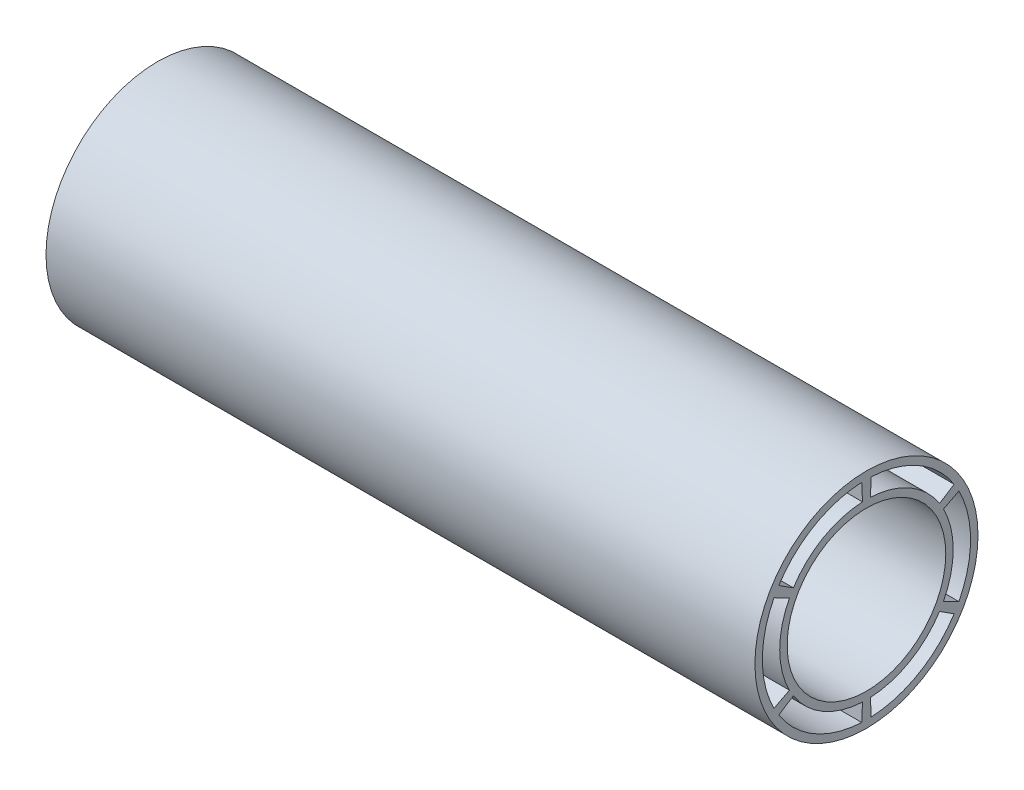
from build123d import *

# Parameters (mm, degrees)
SKETCH1_R           = 22.5
SKETCH1_R_2         = 16
BOSS_EXTRUDE1_DEPTH = 143


with BuildPart() as part:
    # Sketch1 → Boss-Extrude1 (new body)
    with BuildSketch(Plane(origin=(0, 0, 0), x_dir=(0, 0, -1), z_dir=(1, 0, 0))):
        Circle(SKETCH1_R)
        with BuildLine():
            ThreePointArc((0.798223616, -17.481785923), (8.75, -15.155444566), (14.740558905, -9.432174891))
            Line((14.740558905, -9.432174891), (17.688670686, -11.318609869))
            ThreePointArc((17.688670686, -11.318609869), (10.5, -18.186533479), (0.95786834, -20.978143108))
            Line((0.95786834, -20.978143108), (0.798223616, -17.481785923))
        make_face(mode=Mode.SUBTRACT)
        with BuildLine():
            Line((18.646539025, -9.659533238), (15.538782521, -8.049611032))
            ThreePointArc((15.538782521, -8.049611032), (17.5, 0), (15.538782521, 8.049611032))
            Line((15.538782521, 8.049611032), (18.646539025, 9.659533238))
            ThreePointArc((18.646539025, 9.659533238), (21, 0), (18.646539025, -9.659533238))
        make_face(mode=Mode.SUBTRACT)
        with BuildLine():
            Line((-0.798223616, -17.481785923), (-0.95786834, -20.978143108))
            ThreePointArc((-0.95786834, -20.978143108), (-10.5, -18.186533479), (-17.688670686, -11.318609869))
            Line((-17.688670686, -11.318609869), (-14.740558905, -9.432174891))
            ThreePointArc((-14.740558905, -9.432174891), (-8.75, -15.155444566), (-0.798223616, -17.481785923))
        make_face(mode=Mode.SUBTRACT)
        with BuildLine():
            Line((17.688670686, 11.318609869), (14.740558905, 9.432174891))
            ThreePointArc((14.740558905, 9.432174891), (8.75, 15.155444566), (0.798223616, 17.481785923))
            Line((0.798223616, 17.481785923), (0.95786834, 20.978143108))
            ThreePointArc((0.95786834, 20.978143108), (10.5, 18.186533479), (17.688670686, 11.318609869))
        make_face(mode=Mode.SUBTRACT)
        with BuildLine():
            Line((-15.538782521, -8.049611032), (-18.646539025, -9.659533238))
            ThreePointArc((-18.646539025, -9.659533238), (-21, 0), (-18.646539025, 9.659533238))
            Line((-18.646539025, 9.659533238), (-15.538782521, 8.049611032))
            ThreePointArc((-15.538782521, 8.049611032), (-17.5, 0), (-15.538782521, -8.049611032))
        make_face(mode=Mode.SUBTRACT)
        with BuildLine():
            Line((-0.95786834, 20.978143108), (-0.798223616, 17.481785923))
            ThreePointArc((-0.798223616, 17.481785923), (-8.75, 15.155444566), (-14.740558905, 9.432174891))
            Line((-14.740558905, 9.432174891), (-17.688670686, 11.318609869))
            ThreePointArc((-17.688670686, 11.318609869), (-10.5, 18.186533479), (-0.95786834, 20.978143108))
        make_face(mode=Mode.SUBTRACT)
        Circle(SKETCH1_R_2, mode=Mode.SUBTRACT)
    extrude(amount=BOSS_EXTRUDE1_DEPTH)


solid = part.part
